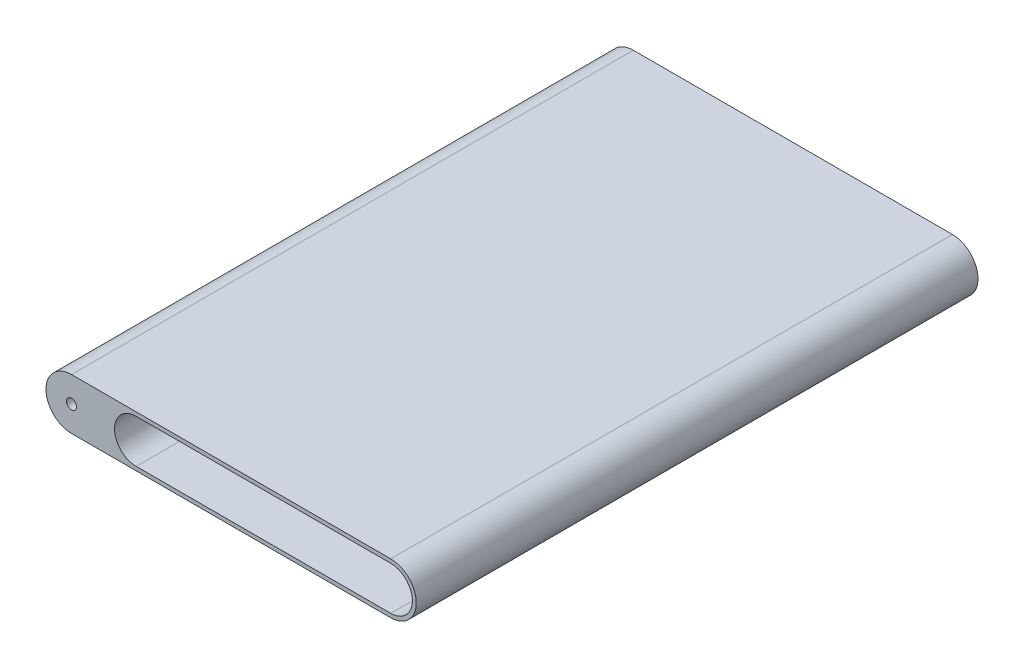
from build123d import *

# Parameters (mm, degrees)
BOSS_EXTRUDE2_DEPTH = 1117.6
SKETCH3_R           = 10
CUT_EXTRUDE1_DEPTH  = 1117.6


with BuildPart() as part:
    # Sketch2 → Boss-Extrude2 (new body)
    with BuildSketch(Plane.XY):
        with BuildLine():
            Line((0, -50.8), (-635, -50.8))
            ThreePointArc((-635, -50.8), (-685.8, 0), (-635, 50.8))
            Line((-635, 50.8), (0, 50.8))
            ThreePointArc((0, 50.8), (50.8, 0), (0, -50.8))
        make_face()
    extrude(amount=BOSS_EXTRUDE2_DEPTH)

    # Sketch3 → Cut-Extrude1 (cut)
    with BuildSketch(Plane.XY.offset(1117.6)):
        with Locations((-635, 0)):
            Circle(SKETCH3_R)
        with BuildLine():
            Line((0, -43.104643513), (-506.395864425, -43.104643513))
            ThreePointArc((-506.395864425, -43.104643513), (-549.500507938, 0), (-506.395864425, 43.104643513))
            Line((-506.395864425, 43.104643513), (0, 43.104643513))
            ThreePointArc((0, 43.104643513), (43.104643513, 0), (0, -43.104643513))
        make_face()
    extrude(amount=-CUT_EXTRUDE1_DEPTH, mode=Mode.SUBTRACT)


solid = part.part
